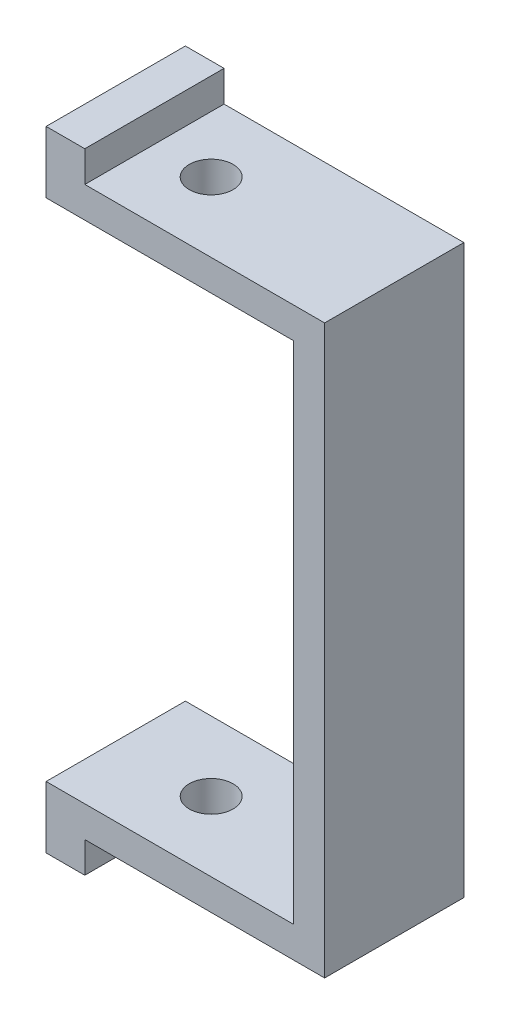
from build123d import *

# Parameters (mm, degrees)
SALIENTE_EXTRUIR1_DEPTH = 13.5
CROQUIS4_R              = 2.125
CORTAR_EXTRUIR1_DEPTH   = 76


with BuildPart() as part:
    # Croquis1 → Saliente-Extruir1 (new body)
    with BuildSketch(Plane.XY):
        Polygon((3.75, 0), (27, 0), (27, 55), (3.75, 55), (3.75, 58), (0, 58), (0, 55), (0, 52), (24, 52), (24, 3), (0, 3), (0, 0), (0, -3), (3.75, -3), align=None)
    extrude(amount=SALIENTE_EXTRUIR1_DEPTH)

    # Croquis4 → Cortar-Extruir1 (cut)
    with BuildSketch(Plane.XZ):
        with Locations(Location((9.25, 6.75, 0), (0, 0, 270))):
            Circle(CROQUIS4_R)
    extrude(amount=-CORTAR_EXTRUIR1_DEPTH, mode=Mode.SUBTRACT)


solid = part.part
